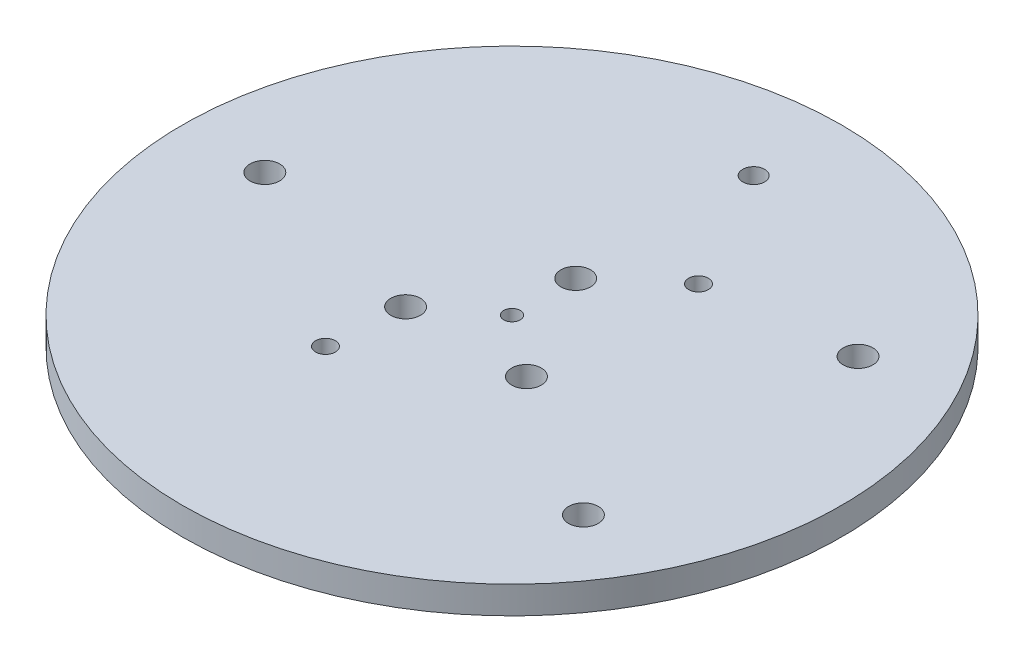
from build123d import *

# Parameters (mm, degrees)
SKETCH1_R           = 76.2
BOSS_EXTRUDE1_DEPTH = 6.35
SKETCH2_R           = 1.905
CUT_EXTRUDE1_DEPTH  = 108.95
SKETCH3_R           = 3.429
CUT_EXTRUDE2_DEPTH  = 108.95
SKETCH4_R           = 3.429
CUT_EXTRUDE3_DEPTH  = 108.95
SKETCH5_R           = 2.54
CUT_EXTRUDE4_DEPTH  = 108.95
CUT_EXTRUDE5_DEPTH  = 108.95


with BuildPart() as part:
    # Sketch1 → Boss-Extrude1 (new body)
    with BuildSketch(Plane(origin=(0, 0, 0), x_dir=(1, 0, 0), z_dir=(0, 1, 0))):
        with Locations(Location((0, 0, 0), (0, 0, 270))):
            Circle(SKETCH1_R)
    extrude(amount=BOSS_EXTRUDE1_DEPTH)

    # Sketch2 → Cut-Extrude1 (cut, through all)
    with BuildSketch(Plane(origin=(0, 6.35, 0), x_dir=(1, 0, 0), z_dir=(0, 1, 0))):
        with Locations(Location((0, 0, 0), (0, 0, 270))):
            Circle(SKETCH2_R)
    extrude(amount=-CUT_EXTRUDE1_DEPTH, mode=Mode.SUBTRACT)

    # Sketch3 → Cut-Extrude2 (cut, through all)
    with BuildSketch(Plane(origin=(0, 6.35, 0), x_dir=(1, 0, 0), z_dir=(0, 1, 0))):
        with Locations(Location((0, 14.732, 0), (0, 0, 270))):
            Circle(SKETCH3_R)
        with Locations(Location((-13.97, -10.631143259, 0), (0, 0, 270))):
            Circle(SKETCH3_R)
        with Locations(Location((13.97, -10.631143259, 0), (0, 0, 270))):
            Circle(SKETCH3_R)
    extrude(amount=-CUT_EXTRUDE2_DEPTH, mode=Mode.SUBTRACT)

    # Sketch4 → Cut-Extrude3 (cut, through all)
    with BuildSketch(Plane(origin=(0, 6.35, 0), x_dir=(1, 0, 0), z_dir=(0, 1, 0))):
        with Locations(Location((-57.15, 0, 0), (0, 0, 270))):
            Circle(SKETCH4_R)
        with Locations(Location((48.26, 31.75, 0), (0, 0, 270))):
            Circle(SKETCH4_R)
        with Locations(Location((48.26, -31.75, 0), (0, 0, 270))):
            Circle(SKETCH4_R)
    extrude(amount=-CUT_EXTRUDE3_DEPTH, mode=Mode.SUBTRACT)

    # Sketch5 → Cut-Extrude4 (cut, through all)
    with BuildSketch(Plane(origin=(0, 6.35, 0), x_dir=(1, 0, 0), z_dir=(0, 1, 0))):
        with Locations(Location((0, 55.88, 0), (0, 0, 270))):
            Circle(SKETCH5_R)
    extrude(amount=-CUT_EXTRUDE4_DEPTH, mode=Mode.SUBTRACT)

    # Sketch6 → Cut-Extrude5 (cut, through all)
    with BuildSketch(Plane(origin=(0, 6.35, 0), x_dir=(1, 0, 0), z_dir=(0, 1, 0))):
        with BuildLine():
            ThreePointArc((-13.024260998, -27.814715677), (-13.342299809, -26.651562737), (-14.207922206, -25.812056148))
            Line((-14.207922206, -25.812056148), (-16.412599789, -29.817375206))
            ThreePointArc((-16.412599789, -29.817375206), (-14.147108058, -29.782676865), (-13.024260998, -27.814715677))
        make_face()
        with BuildLine():
            Line((-16.412599789, -29.817375206), (-14.207922206, -25.812056148))
            ThreePointArc((-14.207922206, -25.812056148), (-17.312920526, -26.712376885), (-16.412599789, -29.817375206))
        make_face()
        with BuildLine():
            ThreePointArc((17.596260998, 27.814715677), (17.278222186, 28.977868616), (16.412599789, 29.817375206))
            Line((16.412599789, 29.817375206), (14.207922206, 25.812056148))
            ThreePointArc((14.207922206, 25.812056148), (16.473413937, 25.846754488), (17.596260998, 27.814715677))
        make_face()
        with BuildLine():
            Line((14.207922206, 25.812056148), (16.412599789, 29.817375206))
            ThreePointArc((16.412599789, 29.817375206), (13.307601469, 28.917054469), (14.207922206, 25.812056148))
        make_face()
    extrude(amount=-CUT_EXTRUDE5_DEPTH, mode=Mode.SUBTRACT)


solid = part.part
